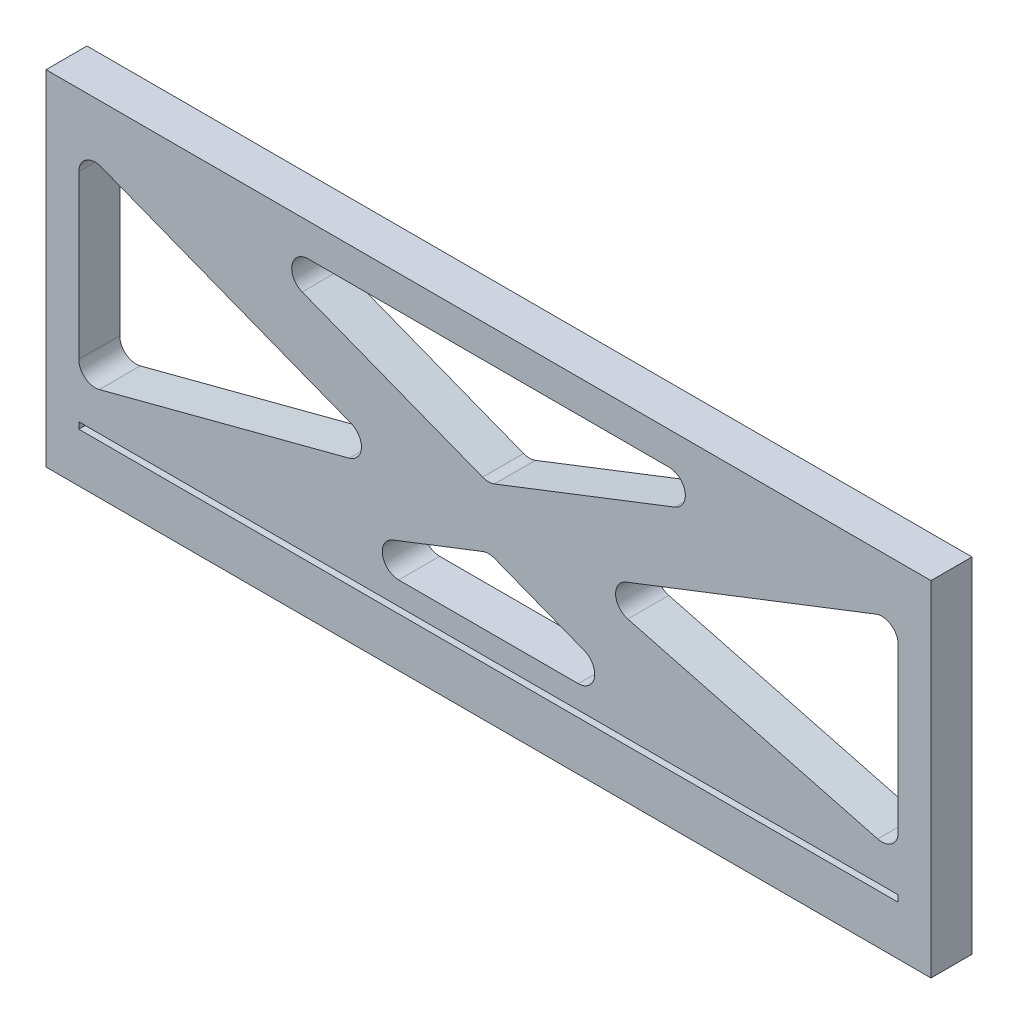
from build123d import *

# Parameters (mm, degrees)
SKETCH1_W           = 68.58
SKETCH1_H           = 26.67
SKETCH1_W_2         = 63.5
SKETCH1_H_2         = 0.5
BOSS_EXTRUDE1_DEPTH = 3.175
FILLET1_R           = 1.27


with BuildPart() as part:
    # Sketch1 → Boss-Extrude1 (new body)
    with BuildSketch(Plane.XY):
        Rectangle(SKETCH1_W, SKETCH1_H)
        Polygon((-20.750635985, 10.795), (0, 2.725308228), (20.750635985, 10.795), align=None, mode=Mode.SUBTRACT)
        with Locations((0, -9.275)):
            Rectangle(SKETCH1_W_2, SKETCH1_H_2, mode=Mode.SUBTRACT)
        Polygon((-31.75, 9.621913994), (-31.75, -6.485), (-7.007935444, 0), align=None, mode=Mode.SUBTRACT)
        Polygon((7.007935444, 0), (31.75, 9.621913994), (31.75, -6.485), align=None, mode=Mode.SUBTRACT)
        Polygon((0, -1.90771576), (-13.729588047, -7.247), (13.729588047, -7.247), align=None, mode=Mode.SUBTRACT)
    extrude(amount=BOSS_EXTRUDE1_DEPTH)

    # Fillet1
    fillet1_edges = [part.edges().sort_by_distance(p)[0] for p in [
        (20.750635985, 10.795, 1.5875),
        (-20.750635985, 10.795, 1.5875),
        (0, 2.725308228, 1.5875),
        (-7.007935444, 0, 1.5875),
        (-31.75, 9.621913994, 1.5875),
        (-31.75, -6.485, 1.5875),
        (7.007935444, 0, 1.5875),
        (31.75, -6.485, 1.5875),
        (31.75, 9.621913994, 1.5875),
        (13.729588047, -7.247, 1.5875),
        (0, -1.90771576, 1.5875),
        (-13.729588047, -7.247, 1.5875),
    ]]
    fillet(fillet1_edges, radius=FILLET1_R)


solid = part.part
